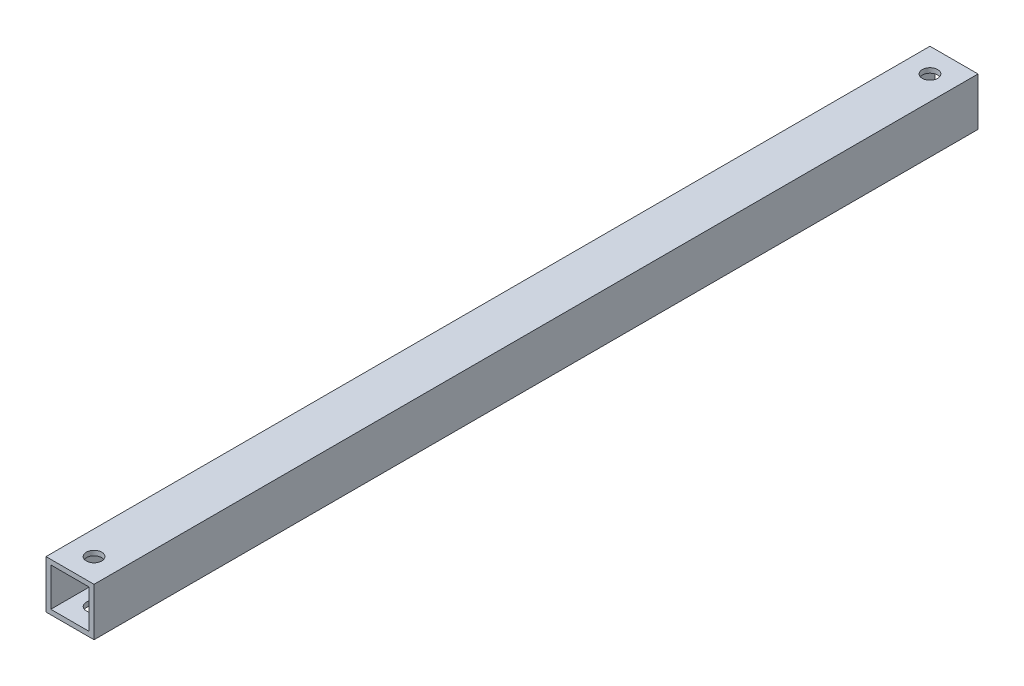
from build123d import *

# Parameters (mm, degrees)
SKETCH_282_W          = 10
SKETCH_282_H          = 10
SKETCH_282_W_2        = 8
SKETCH_282_H_2        = 8
EXTRUDE_339_DEPTH     = 184
SKETCH_411_R          = 1.6
CUT_EXTRUDE_748_DEPTH = 185.339360962


with BuildPart() as part:
    # Sketch 282 → Extrude 339 (new body)
    with BuildSketch(Plane.XY):
        Rectangle(SKETCH_282_W, SKETCH_282_H)
        Rectangle(SKETCH_282_W_2, SKETCH_282_H_2, mode=Mode.SUBTRACT)
    extrude(amount=EXTRUDE_339_DEPTH)

    # Sketch 411 → Cut-Extrude 748 (cut, through all)
    with BuildSketch(Plane(origin=(0, 5, 0), x_dir=(1, 0, 0), z_dir=(0, 1, 0))):
        with Locations(Location((0, -5, 0), (0, 0, 270))):
            Circle(SKETCH_411_R)
        with Locations(Location((0, -179, 0), (0, 0, 270))):
            Circle(SKETCH_411_R)
    extrude(amount=-CUT_EXTRUDE_748_DEPTH, mode=Mode.SUBTRACT)


solid = part.part
